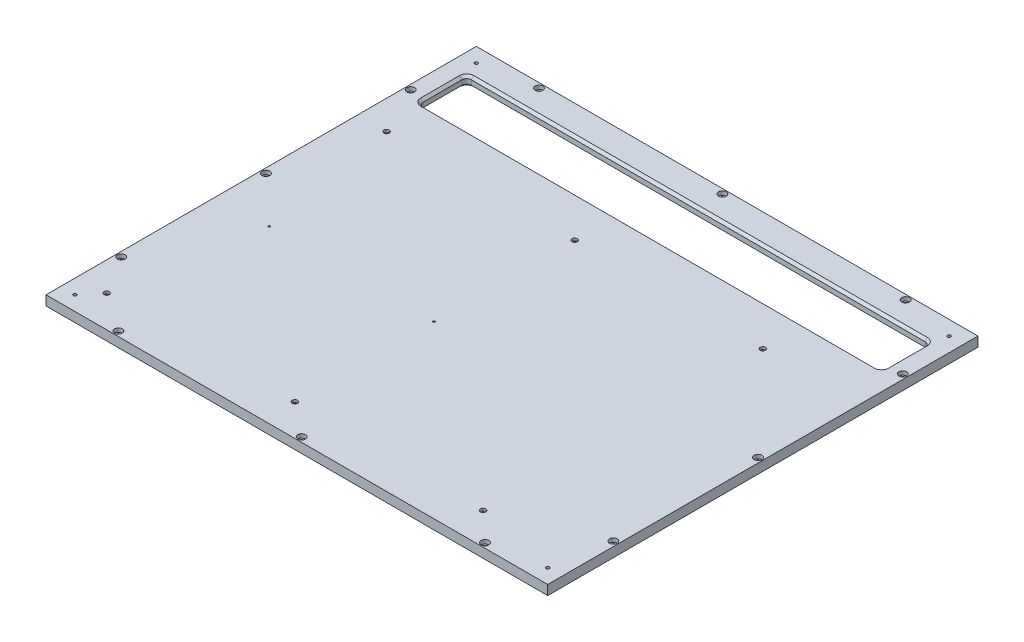
from build123d import *

# Parameters (mm, degrees)
SKETCH1_W                        = 520
SKETCH1_H                        = 446
BOSS_EXTRUDE1_DEPTH              = 10
SKETCH4_W                        = 480
SKETCH4_H                        = 50
CUT_EXTRUDE1_DEPTH               = 10
FILLET1_R                        = 5
CHAMFER1_SIZE                    = 2.5
CBORE_FOR_M4_SHCS1_D             = 4.5
CBORE_FOR_M4_SHCS1_DEPTH         = 12
CBORE_FOR_M4_SHCS1_CBORE_D       = 8
CBORE_FOR_M4_SHCS1_CBORE_DEPTH   = 4
CBORE_FOR_M4_SHCS1_TIP           = 1.351936393
M4X0_7_TAPPED_HOLE1_D            = 3.3
CBORE_FOR_M2_5_SHCS1_D           = 2.9
CBORE_FOR_M2_5_SHCS1_CBORE_D     = 5.5
CBORE_FOR_M2_5_SHCS1_CBORE_DEPTH = 2.5
M2_5X0_45_TAPPED_HOLE1_D         = 2.05


with BuildPart() as part:
    # Sketch1 → Boss-Extrude1 (new body)
    with BuildSketch(Plane(origin=(0, 0, 0), x_dir=(1, 0, 0), z_dir=(0, 1, 0))):
        with Locations((260, 223)):
            Rectangle(SKETCH1_W, SKETCH1_H)
    extrude(amount=BOSS_EXTRUDE1_DEPTH)

    # Sketch4 → Cut-Extrude1 (cut)
    with BuildSketch(Plane(origin=(0, 10, 0), x_dir=(1, 0, 0), z_dir=(0, 1, 0))):
        with Locations((260, 391)):
            Rectangle(SKETCH4_W, SKETCH4_H)
    extrude(amount=-CUT_EXTRUDE1_DEPTH, mode=Mode.SUBTRACT)

    # Fillet1
    fillet1_edges = [part.edges().sort_by_distance(p)[0] for p in [
        (500, 5, -416),
        (500, 5, -366),
        (20, 5, -366),
        (20, 5, -416),
    ]]
    fillet(fillet1_edges, radius=FILLET1_R)

    # Chamfer1
    chamfer1_edges = [part.edges().sort_by_distance(p)[0] for p in [
        (500, 10, -391),
        (500, 0, -391),
        (260, 10, -366),
        (260, 0, -366),
        (20, 10, -391),
        (20, 0, -391),
        (260, 10, -416),
        (260, 0, -416),
        (498.535533906, 10, -367.464466094),
        (498.535533906, 0, -367.464466094),
        (21.464466094, 10, -414.535533906),
        (21.464466094, 0, -414.535533906),
        (498.535533906, 10, -414.535533906),
        (498.535533906, 0, -414.535533906),
        (21.464466094, 10, -367.464466094),
        (21.464466094, 0, -367.464466094),
    ]]
    chamfer(chamfer1_edges, length=CHAMFER1_SIZE)

    # CBORE for M4 SHCS1
    with Locations(Plane(origin=(0, 10, 0), x_dir=(1, 0, 0), z_dir=(0, 1, 0))):
        with Locations((5, 373), (5, 223), (5, 73), (70, 5), (260, 5), (450, 5), (515, 73), (515, 223), (515, 373), (450, 441), (260, 441), (70, 441)):
            CounterBoreHole(CBORE_FOR_M4_SHCS1_D / 2, CBORE_FOR_M4_SHCS1_CBORE_D / 2, CBORE_FOR_M4_SHCS1_CBORE_DEPTH, depth=CBORE_FOR_M4_SHCS1_DEPTH)
            with Locations((0, 0, -(CBORE_FOR_M4_SHCS1_DEPTH + CBORE_FOR_M4_SHCS1_TIP / 2))):  # 118° drill point
                Cone(0, CBORE_FOR_M4_SHCS1_D / 2, CBORE_FOR_M4_SHCS1_TIP, mode=Mode.SUBTRACT)

    # M4x0.7 Tapped Hole1 (through all)
    with Locations(Plane(origin=(0, 10, 0), x_dir=(1, 0, 0), z_dir=(0, 1, 0))):
        with Locations((15, 431), (505, 431), (15, 15), (505, 15)):
            Hole(M4X0_7_TAPPED_HOLE1_D / 2)

    # CBORE for M2.5 SHCS1 (through all)
    with Locations(Plane(origin=(0, 10, 0), x_dir=(1, 0, 0), z_dir=(0, 1, 0))):
        with Locations((30, 33), (225, 33), (420, 33), (420, 323), (225, 323), (30, 323)):
            CounterBoreHole(CBORE_FOR_M2_5_SHCS1_D / 2, CBORE_FOR_M2_5_SHCS1_CBORE_D / 2, CBORE_FOR_M2_5_SHCS1_CBORE_DEPTH)

    # M2.5x0.45 Tapped Hole1 (through all)
    with Locations(Plane(origin=(0, 10, 0), x_dir=(1, 0, 0), z_dir=(0, 1, 0))):
        with Locations((54.288, 177.08759), (225.088, 177.08759)):
            Hole(M2_5X0_45_TAPPED_HOLE1_D / 2)


solid = part.part
